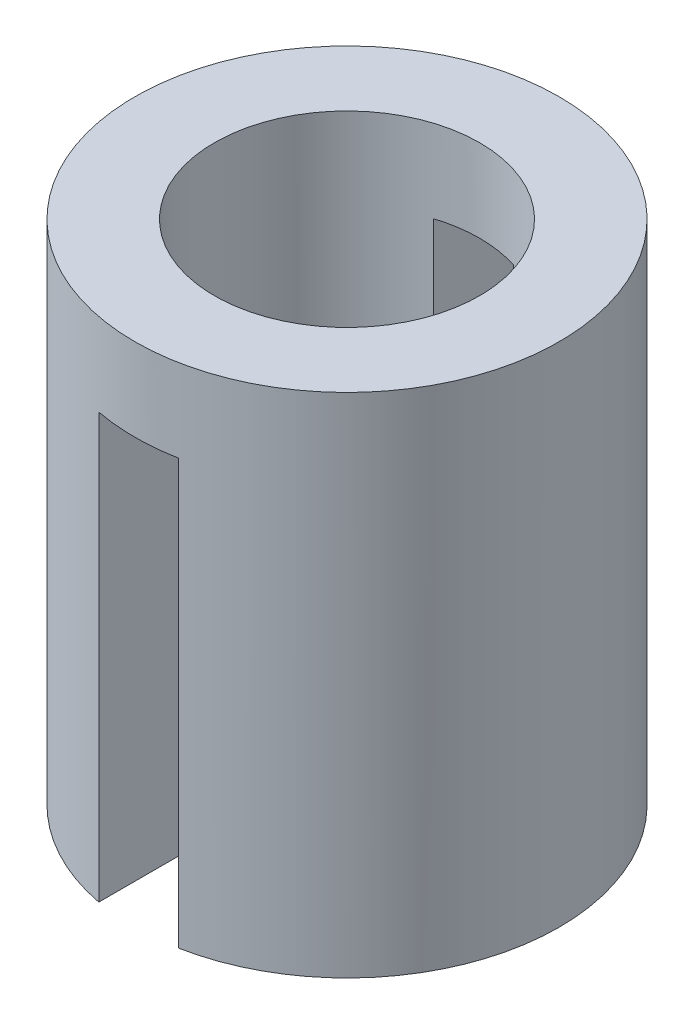
from build123d import *

# Parameters (mm, degrees)
SKETCH2_W               = 0.75
SKETCH2_H               = 4.78
CUT_EXTRUDE1_DEPTH      = 4.78
CUT_EXTRUDE1_DEPTH_BACK = 4.78
SKETCH3_W               = 0.75
SKETCH3_H               = 4


with BuildPart() as part:
    # Sketch2 → Revolve1 (revolve)
    with BuildSketch(Plane.XY):
        with Locations((1.625, 2.39)):
            Rectangle(SKETCH2_W, SKETCH2_H)
    revolve(axis=Axis((0, -55, 0), (0, 1, 0)))

    # Sketch3 → Cut-Extrude1 (cut, two sides: drawn at the far end of the back side and taken through both)
    with BuildSketch(Plane.XY.offset(-CUT_EXTRUDE1_DEPTH_BACK)):
        with Locations((0, 2)):
            Rectangle(SKETCH3_W, SKETCH3_H)
    extrude(amount=CUT_EXTRUDE1_DEPTH + CUT_EXTRUDE1_DEPTH_BACK, mode=Mode.SUBTRACT)


solid = part.part
